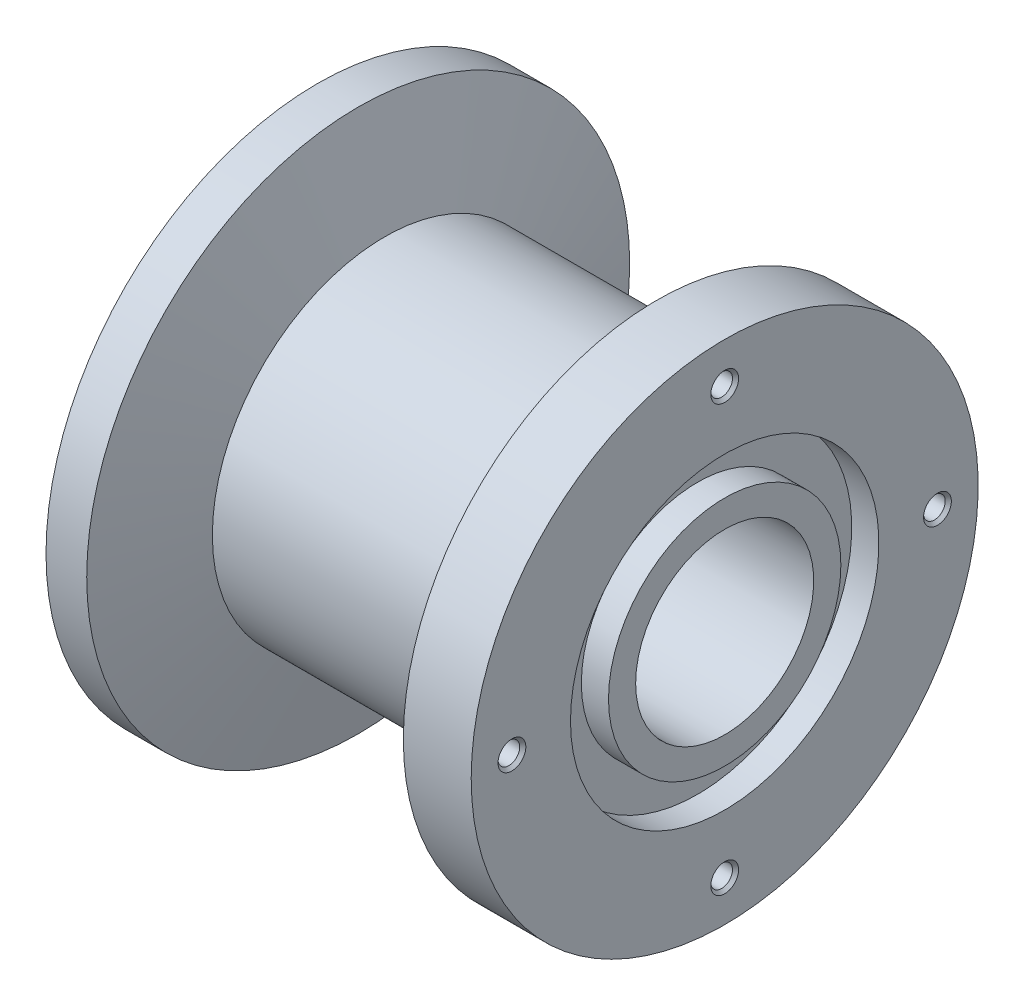
from build123d import *

# Parameters (mm, degrees)
HOLE_WIZARD_M21_D           = 1.6
HOLE_WIZARD_M21_DEPTH       = 5
HOLE_WIZARD_M21_CSINK_D     = 2.05
HOLE_WIZARD_M21_CSINK_ANGLE = 90
PATTERN_CIRCULAR_1_COUNT    = 4


with BuildPart() as part:
    # Эскиз1 → Повернуть1 (revolve)
    with BuildSketch(Plane.XY, mode=Mode.PRIVATE) as revolve_1_sk:
        Polygon((0, 20), (0, 13.2), (2.7, 13.2), (2.7, 6.56), (30, 6.56), (30, 8.56), (28, 8.56), (28, 11.36), (30, 11.36), (30, 18.675), (25, 18.675), (25, 12.7), (4.956029105, 12.7), (3, 20), align=None)
    revolve(revolve_1_sk.sketch.rotate(Axis((-29.041238464, 0, 0), (1, 0, 0)), 90), axis=Axis((-29.041238464, 0, 0), (1, 0, 0)))

    # Отверстие обработанное метчиком M21
    with Locations(Plane(origin=(30, 0, 0), x_dir=(0, 0, -1), z_dir=(1, 0, 0))):
        with Locations((0, 15.675)):
            hole_wizard_m21 = CounterSinkHole(HOLE_WIZARD_M21_D / 2, HOLE_WIZARD_M21_CSINK_D / 2, depth=HOLE_WIZARD_M21_DEPTH, counter_sink_angle=HOLE_WIZARD_M21_CSINK_ANGLE)

    # Круговой массив1: Отверстие обработанное метчиком M21 ×4 about axis
    pattern_circular_1_axis = Axis((0, 0, 0), (1, 0, 0))
    for i in range(1, PATTERN_CIRCULAR_1_COUNT):
        add(hole_wizard_m21.rotate(pattern_circular_1_axis, i * 360 / PATTERN_CIRCULAR_1_COUNT), mode=Mode.SUBTRACT)


solid = part.part
